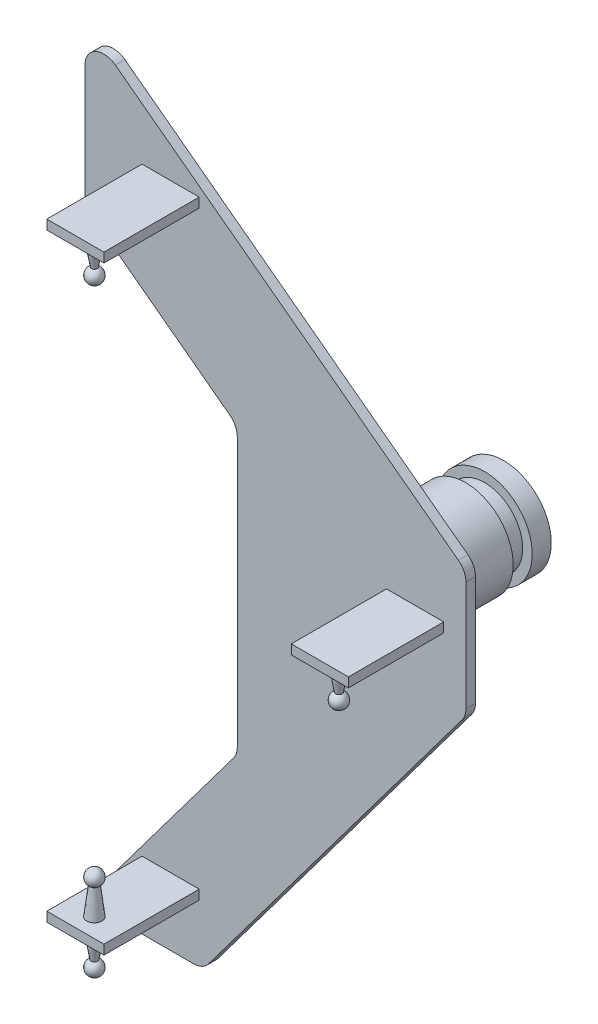
from build123d import *

# Parameters (mm, degrees)
SCHIZZO2_W                    = 200
SCHIZZO2_H                    = 400
ESTRUSIONE_ESTRUSIONE2_DEPTH  = 5
SCHIZZO3_W                    = 30
SCHIZZO3_H                    = 5
ESTRUSIONE_ESTRUSIONE3_DEPTH  = 50
SCHIZZO4_R                    = 4
ESTRUSIONE_ESTRUSIONE4_DEPTH  = 15
ESTRUSIONE_ESTRUSIONE4_TAPER  = 10
SCHIZZO12_R                   = 4
ESTRUSIONE_ESTRUSIONE5_DEPTH  = 15
ESTRUSIONE_ESTRUSIONE5_TAPER  = 9
SCHIZZO15_R                   = 4
ESTRUSIONE_ESTRUSIONE6_DEPTH  = 15
ESTRUSIONE_ESTRUSIONE6_TAPER  = 9
TAGLIO_ESTRUSIONE1_DEPTH      = 451.582955736
RACCORDO1_R                   = 10
SCHIZZO22_R                   = 25
ESTRUSIONE_ESTRUSIONE7_DEPTH  = 85
SCHIZZO23_R                   = 20
ESTRUSIONE_ESTRUSIONE8_DEPTH  = 10
SCHIZZO24_R                   = 25
ESTRUSIONE_ESTRUSIONE9_DEPTH  = 10
SCHIZZO25_R                   = 4
ESTRUSIONE_ESTRUSIONE10_DEPTH = 15
ESTRUSIONE_ESTRUSIONE10_TAPER = 7


with BuildPart() as part:
    # Schizzo2 → Estrusione-Estrusione2 (new body)
    with BuildSketch(Plane.XY):
        with Locations((100, 200)):
            Rectangle(SCHIZZO2_W, SCHIZZO2_H)
    extrude(amount=ESTRUSIONE_ESTRUSIONE2_DEPTH)

    # Schizzo3 → Estrusione-Estrusione3 (add)
    with BuildSketch(Plane.XY.offset(5)):
        with Locations((45, 347.5)):
            Rectangle(SCHIZZO3_W, SCHIZZO3_H)
        with Locations((45, 32.9)):
            Rectangle(SCHIZZO3_W, SCHIZZO3_H)
        with Locations((173.33763157, 218.560826033)):
            Rectangle(SCHIZZO3_W, SCHIZZO3_H)
    extrude(amount=ESTRUSIONE_ESTRUSIONE3_DEPTH)



with BuildPart() as body_2:
    # Schizzo4 → Estrusione-Estrusione4 (new body)
    with BuildSketch(Plane(origin=(0, 345, 0), x_dir=(-1, 0, 0), z_dir=(0, -1, 0))):
        with Locations((-45, -45)):
            Circle(SCHIZZO4_R)
    extrude(amount=ESTRUSIONE_ESTRUSIONE4_DEPTH, taper=ESTRUSIONE_ESTRUSIONE4_TAPER)


with BuildPart() as part_1:
    add(part.part)

    add(body_2.part)  # Rivoluzione1 merges body 2
    # Schizzo10 → Rivoluzione1 (revolve)
    with BuildSketch(Plane.XY.offset(45)):
        with BuildLine():
            Line((41, 327), (49, 327))
            ThreePointArc((49, 327), (45, 331), (41, 327))
        make_face()
    revolve(axis=Axis((41, 327, 45), (1, 0, 0)))

    # Schizzo12 → Estrusione-Estrusione5 (add)
    with BuildSketch(Plane(origin=(0, 216.060826033, 0), x_dir=(-1, 0, 0), z_dir=(0, -1, 0))):
        with Locations((-173.33763157, -45)):
            Circle(SCHIZZO12_R)
    extrude(amount=ESTRUSIONE_ESTRUSIONE5_DEPTH, taper=ESTRUSIONE_ESTRUSIONE5_TAPER)

    # Schizzo14 → Rivoluzione2 (revolve)
    with BuildSketch(Plane.XY.offset(45)):
        with BuildLine():
            Line((169.348992538, 198.060847545), (177.348992538, 198.060847545))
            ThreePointArc((177.348992538, 198.060847545), (173.348992538, 202.060847545), (169.348992538, 198.060847545))
        make_face()
    revolve(axis=Axis((169.348992538, 198.060847545, 45), (1, 0, 0)))

    # Schizzo15 → Estrusione-Estrusione6 (add)
    with BuildSketch(Plane(origin=(0, 30.4, 0), x_dir=(-1, 0, 0), z_dir=(0, -1, 0))):
        with Locations((-45, -45)):
            Circle(SCHIZZO15_R)
    extrude(amount=ESTRUSIONE_ESTRUSIONE6_DEPTH, taper=ESTRUSIONE_ESTRUSIONE6_TAPER)

    # Schizzo18 → Rivoluzione3 (revolve)
    with BuildSketch(Plane.XY.offset(45)):
        with BuildLine():
            Line((41, 12.4), (49, 12.4))
            ThreePointArc((49, 12.4), (45, 16.4), (41, 12.4))
        make_face()
    revolve(axis=Axis((41, 12.4, 45), (1, 0, 0)))

    # Schizzo21 → Taglio-Estrusione1 (cut, through all)
    with BuildSketch(Plane(origin=(0, 0, 0), x_dir=(-1, 0, 0), z_dir=(0, 0, -1))):
        Polygon((0, 400), (-200, 400), (-200, 250), align=None)
        Polygon((-200, 0), (-200, 184), (-62, 0), align=None)
        Polygon((0, 180.234598916), (0, 316.003213066), (-80, 256.003213066), (-80, 106.666666667), (0, 0), align=None)
    extrude(amount=-TAGLIO_ESTRUSIONE1_DEPTH, mode=Mode.SUBTRACT)

    # Raccordo1
    raccordo1_edges = [part_1.edges().sort_by_distance(p)[0] for p in [
        (200, 250, 2.5),
        (0, 400, 2.5),
        (0, 0, 2.5),
        (62, 0, 2.5),
        (200, 184, 2.5),
        (80, 106.666666667, 2.5),
        (80, 256.003213066, 2.5),
        (0, 316.003213066, 2.5),
    ]]
    fillet(raccordo1_edges, radius=RACCORDO1_R)

    # Schizzo22 → Estrusione-Estrusione7 (add)
    with BuildSketch(Plane(origin=(0, 0, 0), x_dir=(-1, 0, 0), z_dir=(0, 0, -1))):
        with Locations((-109.818961105, 175.150625292)):
            Circle(SCHIZZO22_R)
    extrude(amount=ESTRUSIONE_ESTRUSIONE7_DEPTH)

    # Schizzo23 → Estrusione-Estrusione8 (add)
    with BuildSketch(Plane(origin=(0, 0, -85), x_dir=(-1, 0, 0), z_dir=(0, 0, -1))):
        with Locations((-109.818961105, 175.150625292)):
            Circle(SCHIZZO23_R)
    extrude(amount=ESTRUSIONE_ESTRUSIONE8_DEPTH)

    # Schizzo24 → Estrusione-Estrusione9 (add)
    with BuildSketch(Plane(origin=(0, 0, -95), x_dir=(-1, 0, 0), z_dir=(0, 0, -1))):
        with Locations((-109.818961105, 175.150625292)):
            Circle(SCHIZZO24_R)
    extrude(amount=ESTRUSIONE_ESTRUSIONE9_DEPTH)

    # Schizzo25 → Estrusione-Estrusione10 (add)
    with BuildSketch(Plane(origin=(0, 35.4, 0), x_dir=(1, 0, 0), z_dir=(0, 1, 0))):
        with Locations((45, -45)):
            Circle(SCHIZZO25_R)
    extrude(amount=ESTRUSIONE_ESTRUSIONE10_DEPTH, taper=ESTRUSIONE_ESTRUSIONE10_TAPER)

    # Schizzo27 → Rivoluzione4 (revolve)
    with BuildSketch(Plane.XY.offset(45)):
        with BuildLine():
            Line((41, 53.4), (49, 53.4))
            ThreePointArc((49, 53.4), (45, 49.4), (41, 53.4))
        make_face()
    revolve(axis=Axis((41, 53.4, 45), (1, 0, 0)))


solid = part_1.part
